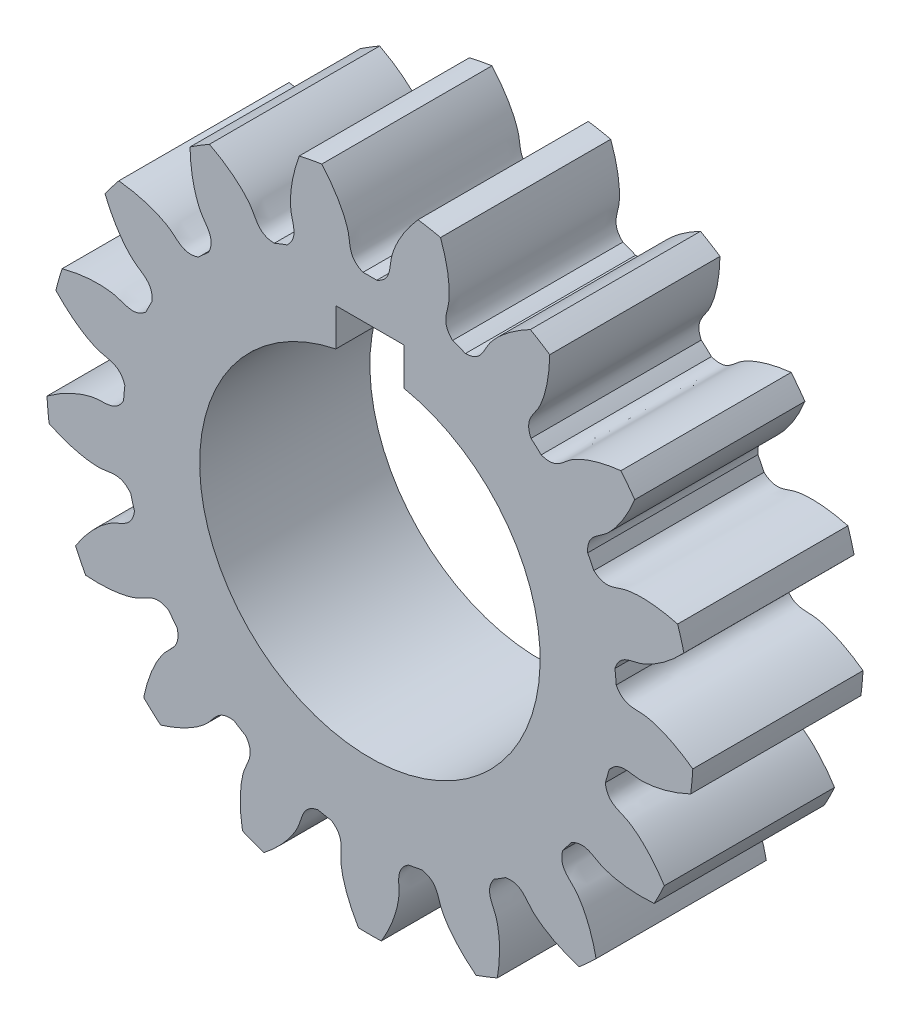
from build123d import *

# Parameters (mm, degrees)
SKETCH_1_R               = 19
EXTRUDE_1_DEPTH          = 10
CUT_EXTRUDE_1_DEPTH      = 29.670542374
PATTERN_CIRCULAR_1_COUNT = 17
CUT_EXTRUDE_2_DEPTH      = 29.650064525


with BuildPart() as part:
    # 草图1 → 凸台-拉伸1 (new body)
    with BuildSketch(Plane.XY):
        Circle(SKETCH_1_R)
    extrude(amount=EXTRUDE_1_DEPTH)

    # 草图2 → 切除-拉伸1 (cut, through all)
    with BuildSketch(Plane.XY):
        with BuildLine():
            ThreePointArc((0.403387494, 14.494387829), (0, 14.5), (-0.403387494, 14.494387829))
            add(Edge.make_bspline(
                [(-0.403387494, 14.494387829), (-1.255759481, 14.849644042), (-1.132390756, 15.509626813), (-1.276611209, 16.129648275), (-1.289951469, 16.18230119), (-1.306037005, 16.240838627), (-1.32510118, 16.305170665), (-1.347383555, 16.375198727), (-1.373118159, 16.450817515), (-1.40253689, 16.531914502), (-1.435868224, 16.618370188), (-1.473337358, 16.710058129), (-1.515165928, 16.80684504), (-1.561571855, 16.908590882), (-1.612769151, 17.015148962), (-1.66896775, 17.12636603), (-1.730373323, 17.242082389), (-1.797187111, 17.362132), (-1.869605751, 17.4863426), (-1.947821109, 17.61453582), (-2.032020115, 17.746527309), (-2.1223846, 17.882126855), (-2.219091138, 18.021138524), (-2.32231089, 18.163360791), (-2.432209452, 18.308586678), (-2.548946705, 18.456603899), (-2.67267667, 18.607195006), (-2.803547366, 18.760137539), (-2.941700674, 18.915204179), (-3.087272199, 19.072162909), (-3.24039114, 19.23077717), (-3.401180166, 19.390806026), (-3.569755292, 19.552004336), (-3.746225758, 19.71412292), (-3.930693918, 19.876908731), (-4.123255131, 20.040105038), (-4.323997649, 20.203451599), (-4.533002522, 20.366684847), (-4.750343497, 20.529538073), (-4.976086928, 20.691741613), (-5.210291694, 20.853023038), (-5.453009069, 21.013107349), (-5.79164327, 21.226861067), (-6.053153804, 21.381051942), (-6.231291666, 21.481438237)],
                knots=[0, 0, 0, 0, 0.193882922, 0.199023975, 0.204850501, 0.211362501, 0.218559975, 0.226442923, 0.235011345, 0.24426524, 0.254204608, 0.264829451, 0.276139767, 0.288135557, 0.300816821, 0.314183558, 0.328235769, 0.342973453, 0.358396612, 0.374505244, 0.39129935, 0.408778929, 0.426943982, 0.445794509, 0.46533051, 0.485551984, 0.506458932, 0.528051354, 0.550329249, 0.573292619, 0.596941461, 0.621275778, 0.646295568, 0.672000832, 0.69839157, 0.725467781, 0.753229466, 0.781676625, 0.810809257, 0.840627364, 0.871130943, 0.902319997, 0.934194524, 1, 1, 1, 1], degree=3))
            ThreePointArc((-6.231291666, 21.481438237), (0, 22.366966369), (6.231291666, 21.481438237))
            add(Edge.make_bspline(
                [(0.403387494, 14.494387829), (1.255759481, 14.849644042), (1.132390756, 15.509626813), (1.276611209, 16.129648275), (1.289951469, 16.18230119), (1.306037005, 16.240838627), (1.32510118, 16.305170665), (1.347383555, 16.375198727), (1.373118159, 16.450817515), (1.40253689, 16.531914502), (1.435868224, 16.618370188), (1.473337358, 16.710058129), (1.515165928, 16.80684504), (1.561571855, 16.908590882), (1.612769151, 17.015148962), (1.66896775, 17.12636603), (1.730373323, 17.242082389), (1.797187111, 17.362132), (1.869605751, 17.4863426), (1.947821109, 17.61453582), (2.032020115, 17.746527309), (2.1223846, 17.882126855), (2.219091138, 18.021138524), (2.32231089, 18.163360791), (2.432209452, 18.308586678), (2.548946705, 18.456603899), (2.67267667, 18.607195006), (2.803547366, 18.760137539), (2.941700674, 18.915204179), (3.087272199, 19.072162909), (3.24039114, 19.23077717), (3.401180166, 19.390806026), (3.569755292, 19.552004336), (3.746225758, 19.71412292), (3.930693918, 19.876908731), (4.123255131, 20.040105038), (4.323997649, 20.203451599), (4.533002522, 20.366684847), (4.750343497, 20.529538073), (4.976086928, 20.691741613), (5.210291694, 20.853023038), (5.453009069, 21.013107349), (5.79164327, 21.226861067), (6.053153804, 21.381051942), (6.231291666, 21.481438237)],
                knots=[0, 0, 0, 0, 0.193882922, 0.199023975, 0.204850501, 0.211362501, 0.218559975, 0.226442923, 0.235011345, 0.24426524, 0.254204608, 0.264829451, 0.276139767, 0.288135557, 0.300816821, 0.314183558, 0.328235769, 0.342973453, 0.358396612, 0.374505244, 0.39129935, 0.408778929, 0.426943982, 0.445794509, 0.46533051, 0.485551984, 0.506458932, 0.528051354, 0.550329249, 0.573292619, 0.596941461, 0.621275778, 0.646295568, 0.672000832, 0.69839157, 0.725467781, 0.753229466, 0.781676625, 0.810809257, 0.840627364, 0.871130943, 0.902319997, 0.934194524, 1, 1, 1, 1], degree=3))
        make_face()
    cut_extrude_1 = extrude(amount=CUT_EXTRUDE_1_DEPTH, mode=Mode.SUBTRACT)

    # 阵列(圆周)1: 切除-拉伸1 ×17 about axis
    pattern_circular_1_axis = Axis((0, 0, 10), (0, 0, -1))
    for i in range(1, PATTERN_CIRCULAR_1_COUNT):
        add(cut_extrude_1.rotate(pattern_circular_1_axis, i * 360 / PATTERN_CIRCULAR_1_COUNT), mode=Mode.SUBTRACT)

    # 草图4 → 切除-拉伸2 (cut, through all)
    with BuildSketch(Plane.XY.offset(10)):
        with BuildLine():
            Line((-2, 12), (2, 12))
            Line((2, 12), (2, 9.797958971))
            ThreePointArc((2, 9.797958971), (0, -10), (-2, 9.797958971))
            Line((-2, 9.797958971), (-2, 12))
        make_face()
    extrude(amount=-CUT_EXTRUDE_2_DEPTH, mode=Mode.SUBTRACT)


solid = part.part
